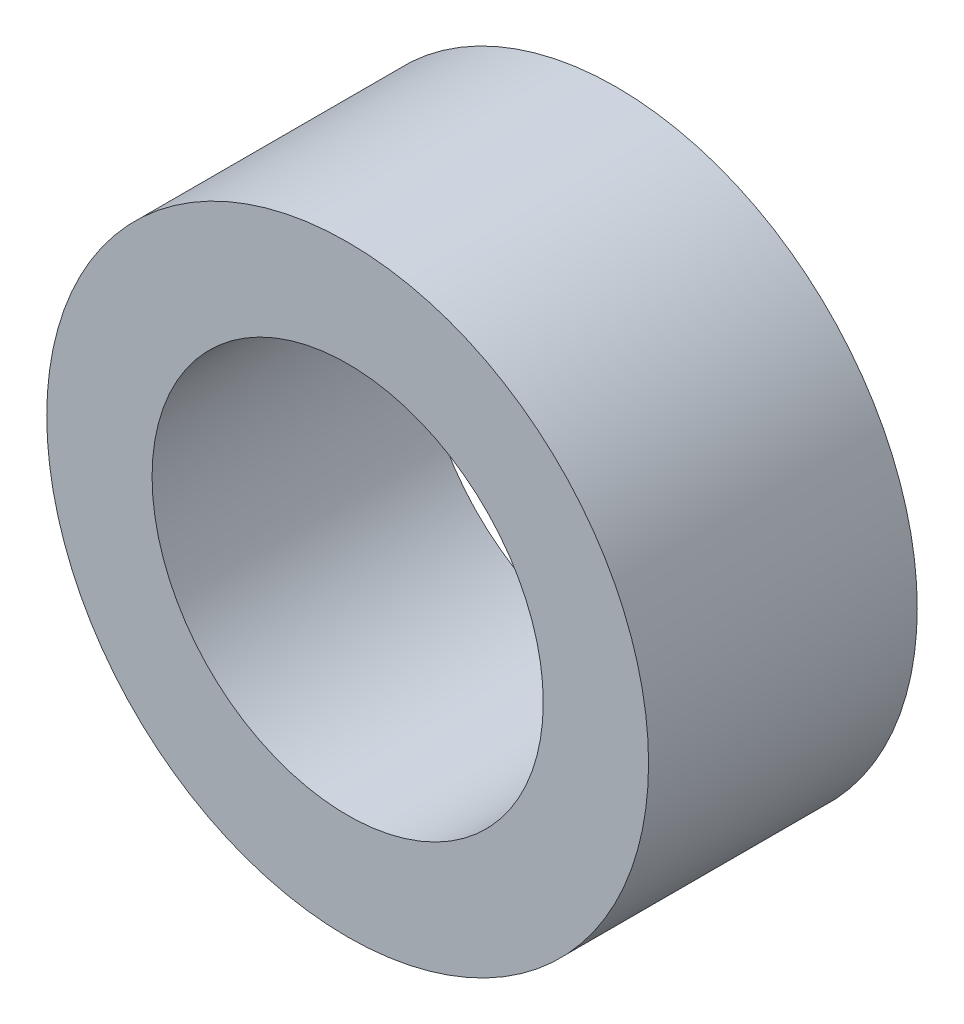
from build123d import *

# Parameters (mm, degrees)
SKETCH1_R           = 10.668
SKETCH1_R_2         = 6.9342
BOSS_EXTRUDE1_DEPTH = 9.525


with BuildPart() as part:
    # Sketch1 → Boss-Extrude1 (new body)
    with BuildSketch(Plane.XY):
        Circle(SKETCH1_R)
        Circle(SKETCH1_R_2, mode=Mode.SUBTRACT)
    extrude(amount=BOSS_EXTRUDE1_DEPTH)


solid = part.part
